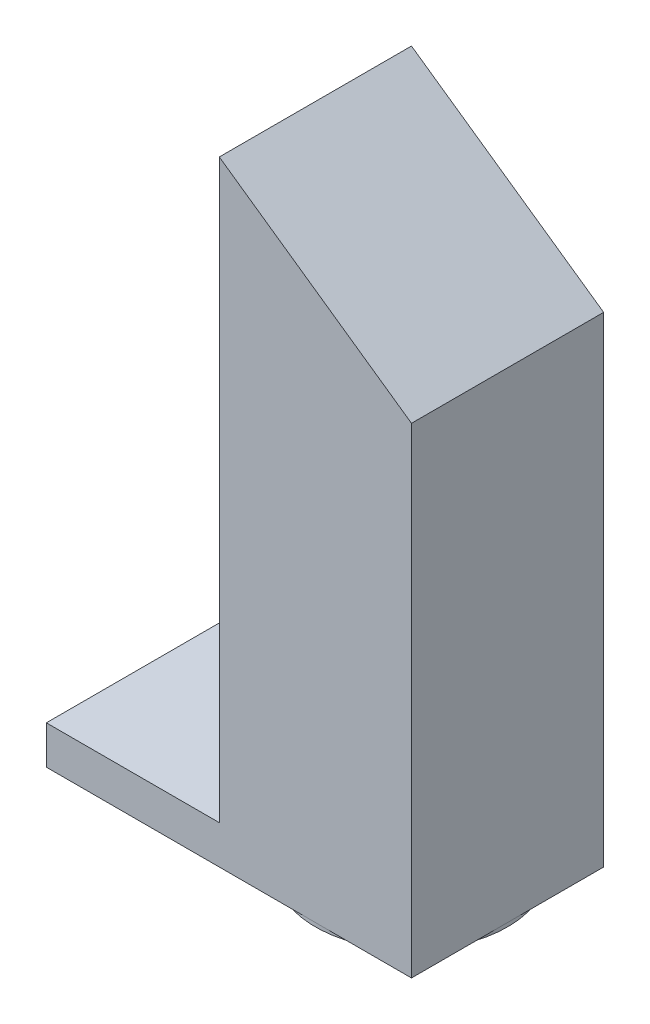
from build123d import *

# Parameters (mm, degrees)
BOSS_EXTRUDE1_DEPTH = 5
SKETCH2_W           = 9.5
SKETCH2_H           = 5
BOSS_EXTRUDE2_DEPTH = 1
SKETCH3_R           = 2.5
BOSS_EXTRUDE3_DEPTH = 0.1


with BuildPart() as part:
    # Sketch1 → Boss-Extrude1 (new body)
    with BuildSketch(Plane.XY):
        Polygon((0, 0), (0, 5), (5, 1.498962309), (5, -10), (0, -10), align=None)
    extrude(amount=BOSS_EXTRUDE1_DEPTH)

    # Sketch2 → Boss-Extrude2 (add)
    with BuildSketch(Plane.XZ.offset(10)):
        with Locations((0.25, 2.5)):
            Rectangle(SKETCH2_W, SKETCH2_H)
    extrude(amount=BOSS_EXTRUDE2_DEPTH)

    # Sketch3 → Boss-Extrude3 (add)
    with BuildSketch(Plane.XZ.offset(11)):
        with Locations(Location((2.5, 2.5, 0), (0, 0, 270))):
            Circle(SKETCH3_R)
    extrude(amount=BOSS_EXTRUDE3_DEPTH)


solid = part.part
